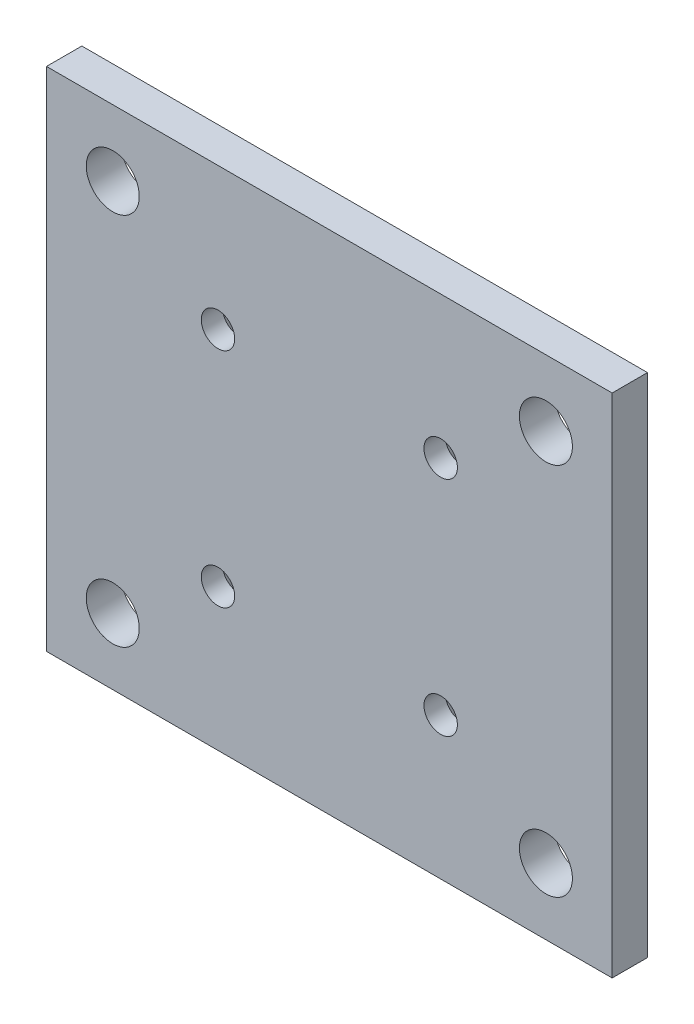
from build123d import *

# Parameters (mm, degrees)
SKETCH2_R           = 1.5
SKETCH2_R_2         = 2.38125
BOSS_EXTRUDE1_DEPTH = 3.175
CHAMFER1_SIZE       = 1.27


with BuildPart() as part:
    # Sketch2 → Boss-Extrude1 (new body)
    with BuildSketch(Plane(origin=(0, 0, -51.1), x_dir=(-1, 0, 0), z_dir=(0, 0, -1))):
        Polygon((13.5, 388.72686963), (25.4, 388.72686963), (25.4, 343.22686963), (13.5, 343.22686963), (-13.5, 343.22686963), (-25.4, 343.22686963), (-25.4, 388.72686963), (-13.5, 388.72686963), align=None)
        with Locations(Location((10, 355.97686963, 0), (0, 0, 90))):
            Circle(SKETCH2_R, mode=Mode.SUBTRACT)
        with Locations(Location((10, 375.97686963, 0), (0, 0, 90))):
            Circle(SKETCH2_R, mode=Mode.SUBTRACT)
        with Locations(Location((-10, 375.97686963, 0), (0, 0, 90))):
            Circle(SKETCH2_R, mode=Mode.SUBTRACT)
        with Locations(Location((-10, 355.97686963, 0), (0, 0, 90))):
            Circle(SKETCH2_R, mode=Mode.SUBTRACT)
        with Locations(Location((19.45, 382.77686963, 0), (0, 0, 90))):
            Circle(SKETCH2_R_2, mode=Mode.SUBTRACT)
        with Locations(Location((-19.45, 382.77686963, 0), (0, 0, 270))):
            Circle(SKETCH2_R_2, mode=Mode.SUBTRACT)
        with Locations(Location((19.45, 349.17686963, 0), (0, 0, 270))):
            Circle(SKETCH2_R_2, mode=Mode.SUBTRACT)
        with Locations(Location((-19.45, 349.17686963, 0), (0, 0, 90))):
            Circle(SKETCH2_R_2, mode=Mode.SUBTRACT)
    extrude(amount=BOSS_EXTRUDE1_DEPTH)

    # Chamfer1
    chamfer1_edges = [part.edges().sort_by_distance(p)[0] for p in [
        (-10, 354.47686963, -54.275),
        (-10, 374.47686963, -54.275),
        (10, 374.47686963, -54.275),
        (10, 354.47686963, -54.275),
    ]]
    chamfer(chamfer1_edges, length=CHAMFER1_SIZE)


solid = part.part
